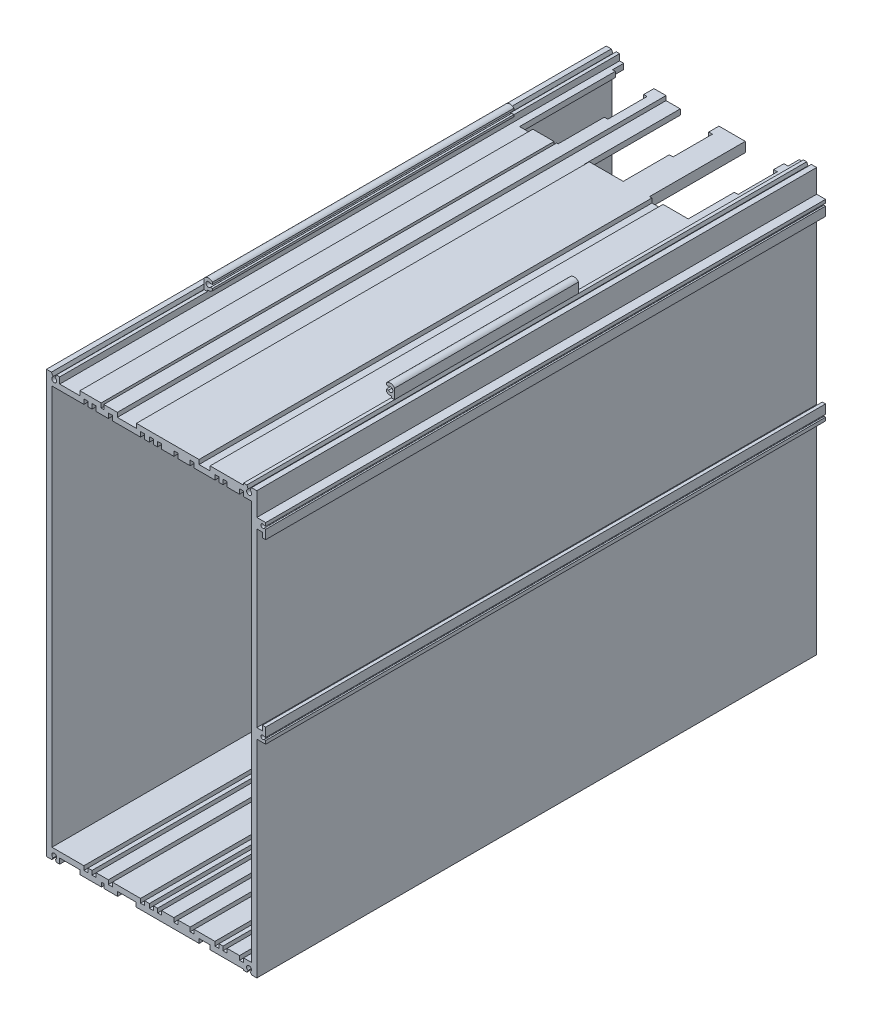
from build123d import *

# Parameters (mm, degrees)
BOSS_EXTRUDE1_DEPTH = 338
BOSS_EXTRUDE2_DEPTH = 188.8
CUT_EXTRUDE3_REACH  = 450.449
SKETCH4_W           = 77.8
SKETCH4_H           = 20.823727225
CUT_EXTRUDE4_REACH  = 446.826
SKETCH5_W           = 106
SKETCH5_H           = 6.75
CUT_EXTRUDE5_REACH  = 446.826
SKETCH6_W           = 23.35
SKETCH6_H           = 57.8
CUT_EXTRUDE6_REACH  = 451.922
SKETCH7_W           = 66.8
SKETCH7_H           = 11.633150893
CUT_EXTRUDE7_REACH  = 446.826
SKETCH8_W           = 2.25
SKETCH8_H           = 23.75


with BuildPart() as part:
    # Sketch2 → Boss-Extrude1 (new body)
    with BuildSketch(Plane.XY):
        with BuildLine():
            Line((14.499999531, 257.585773296), (14.499999531, 261.373383253))
            Line((14.499999531, 261.373383253), (12.499999531, 261.373383253))
            Line((12.499999531, 261.373383253), (11.766447114, 259.574707108))
            ThreePointArc((11.766447114, 259.574707108), (12.4449235, 259.022531512), (12.699999531, 258.185773296))
            ThreePointArc((12.699999531, 258.185773296), (10.428246686, 256.899539434), (10.494136136, 259.509312818))
            Line((10.494136136, 259.509312818), (9.499999531, 261.373383253))
            Line((9.499999531, 261.373383253), (6.499999531, 261.373383253))
            Line((6.499999531, 261.373383253), (6.499999531, 6.573383253))
            Line((6.499999531, 6.573383253), (9.699999531, 6.573383253))
            Line((9.699999531, 6.573383253), (10.453087922, 7.884956995))
            ThreePointArc((10.453087922, 7.884956995), (10.448456922, 10.483919553), (12.699999531, 9.185773296))
            ThreePointArc((12.699999531, 9.185773296), (12.47478685, 8.395256191), (11.866776475, 7.842118389))
            Line((11.866776475, 7.842118389), (12.496375142, 6.573383253))
            Line((12.496375142, 6.573383253), (14.496375142, 6.573383253))
            Line((14.496375142, 6.573383253), (14.496375142, 9.785773296))
            Line((14.496375142, 9.785773296), (26.596375142, 9.785773296))
            Line((26.596375142, 9.785773296), (26.596375142, 7.202035453))
            Line((26.596375142, 7.202035453), (39.696375142, 7.202035453))
            Line((39.696375142, 7.202035453), (39.696375142, 9.785773296))
            Line((39.696375142, 9.785773296), (41.199999531, 9.785773296))
            Line((41.199999531, 9.785773296), (41.199999531, 7.202035453))
            Line((41.199999531, 7.202035453), (49.449999531, 7.202035453))
            Line((49.449999531, 7.202035453), (49.449999531, 9.785773296))
            Line((49.449999531, 9.785773296), (60.549999531, 9.785773296))
            Line((60.549999531, 9.785773296), (60.549999531, 7.202035453))
            Line((60.549999531, 7.202035453), (98.649999531, 7.202035453))
            Line((98.649999531, 7.202035453), (98.649999531, 9.785773296))
            Line((98.649999531, 9.785773296), (105.249999531, 9.785773296))
            Line((105.249999531, 9.785773296), (105.249999531, 7.202035453))
            Line((105.249999531, 7.202035453), (125.499999531, 7.202035453))
            Line((125.499999531, 7.202035453), (125.499999531, 6.573383253))
            Line((125.499999531, 6.573383253), (127.499999531, 6.573383253))
            Line((127.499999531, 6.573383253), (128.131728013, 7.842861095))
            ThreePointArc((128.131728013, 7.842861095), (128.010191731, 10.461000193), (130.299999531, 9.185773296))
            ThreePointArc((130.299999531, 9.185773296), (130.098145789, 8.434230687), (129.54691114, 7.884956995))
            Line((129.54691114, 7.884956995), (130.299999531, 6.573383253))
            Line((130.299999531, 6.573383253), (133.499999531, 6.573383253))
            Line((133.499999531, 6.573383253), (133.499999531, 131.473383253))
            Line((133.499999531, 131.473383253), (138.849999531, 131.473383253))
            Line((138.849999531, 131.473383253), (138.849999531, 133.473383253))
            Line((138.849999531, 133.473383253), (137.935232058, 133.473383253))
            ThreePointArc((137.935232058, 133.473383253), (135.950499999, 134.164830282), (137.890474853, 134.973383253))
            Line((137.890474853, 134.973383253), (138.849999531, 134.973383253))
            Line((138.849999531, 134.973383253), (138.849999531, 140.423383253))
            Line((138.849999531, 140.423383253), (136.899999531, 140.423383253))
            Line((136.899999531, 140.423383253), (136.899999531, 137.473383253))
            Line((136.899999531, 137.473383253), (133.499999531, 137.473383253))
            Line((133.499999531, 137.473383253), (133.499999531, 241.373383253))
            Line((133.499999531, 241.373383253), (136.899999531, 241.373383253))
            Line((136.899999531, 241.373383253), (136.899999531, 238.423383253))
            Line((136.899999531, 238.423383253), (138.849999531, 238.423383253))
            Line((138.849999531, 238.423383253), (138.849999531, 243.873383253))
            Line((138.849999531, 243.873383253), (137.890474853, 243.873383253))
            ThreePointArc((137.890474853, 243.873383253), (135.950499999, 244.681936224), (137.935232058, 245.373383253))
            Line((137.935232058, 245.373383253), (138.849999531, 245.373383253))
            Line((138.849999531, 245.373383253), (138.849999531, 247.373383253))
            Line((138.849999531, 247.373383253), (133.499999531, 247.373383253))
            Line((133.499999531, 247.373383253), (133.499999531, 261.373383253))
            Line((133.499999531, 261.373383253), (130.299999531, 261.373383253))
            Line((130.299999531, 261.373383253), (129.438677048, 259.543009837))
            ThreePointArc((129.438677048, 259.543009837), (130.06649396, 258.989509485), (130.299999531, 258.185773296))
            ThreePointArc((130.299999531, 258.185773296), (127.963241315, 256.940849327), (128.233551948, 259.574707108))
            Line((128.233551948, 259.574707108), (127.499999531, 261.373383253))
            Line((127.499999531, 261.373383253), (125.499999531, 261.373383253))
            Line((125.499999531, 261.373383253), (125.499999531, 260.239968056))
            Line((125.499999531, 260.239968056), (105.299999531, 260.239968056))
            Line((105.299999531, 260.239968056), (105.299999531, 257.585773296))
            Line((105.299999531, 257.585773296), (98.599999531, 257.585773296))
            Line((98.599999531, 257.585773296), (98.599999531, 260.239968056))
            Line((98.599999531, 260.239968056), (60.799999531, 260.239968056))
            Line((60.799999531, 260.239968056), (60.799999531, 257.585773296))
            Line((60.799999531, 257.585773296), (49.299999531, 257.585773296))
            Line((49.299999531, 257.585773296), (49.299999531, 260.239968056))
            Line((49.299999531, 260.239968056), (41.099999531, 260.239968056))
            Line((41.099999531, 260.239968056), (41.099999531, 257.585773296))
            Line((41.099999531, 257.585773296), (39.499999531, 257.585773296))
            Line((39.499999531, 257.585773296), (39.499999531, 260.239968056))
            Line((39.499999531, 260.239968056), (26.699999531, 260.239968056))
            Line((26.699999531, 260.239968056), (26.699999531, 257.585773296))
            Line((26.699999531, 257.585773296), (14.499999531, 257.585773296))
        make_face()
        Polygon((9.799999531, 13.085773296), (9.799999531, 254.285773296), (29.099999531, 254.285773296), (29.099999531, 257.185773296), (31.549999531, 257.185773296), (31.549999531, 254.285773296), (33.999999531, 254.285773296), (33.999999531, 257.185773296), (36.449999531, 257.185773296), (36.449999531, 254.285773296), (43.849999531, 254.285773296), (43.849999531, 257.185773296), (46.299999531, 257.185773296), (46.299999531, 254.285773296), (63.299999531, 254.285773296), (63.299999531, 257.185773296), (65.749999531, 257.185773296), (65.749999531, 254.285773296), (68.649999531, 254.285773296), (68.649999531, 257.185773296), (71.099999531, 257.185773296), (71.099999531, 254.285773296), (73.549999531, 254.285773296), (73.549999531, 257.185773296), (75.999999531, 257.185773296), (75.999999531, 254.285773296), (83.399999531, 254.285773296), (83.399999531, 257.185773296), (85.849999531, 257.185773296), (85.849999531, 254.285773296), (93.249999531, 254.285773296), (93.249999531, 257.185773296), (95.699999531, 257.185773296), (95.699999531, 254.285773296), (108.199999531, 254.285773296), (108.199999531, 257.185773296), (110.649999531, 257.185773296), (110.649999531, 254.285773296), (113.099999531, 254.285773296), (113.099999531, 257.185773296), (115.549999531, 257.185773296), (115.549999531, 254.285773296), (123.049999531, 254.285773296), (123.049999531, 257.185773296), (125.499999531, 257.185773296), (125.499999531, 254.285773296), (130.199999531, 254.285773296), (130.199999531, 13.085773296), (125.499999531, 13.085773296), (125.499999531, 10.605647121), (123.049999531, 10.605647121), (123.049999531, 13.085773296), (115.549999531, 13.085773296), (115.549999531, 10.605647121), (113.099999531, 10.605647121), (113.099999531, 13.085773296), (110.649999531, 13.085773296), (110.649999531, 10.605647121), (108.199999531, 10.605647121), (108.199999531, 13.085773296), (95.699999531, 13.085773296), (95.699999531, 10.605647121), (93.249999531, 10.605647121), (93.249999531, 13.085773296), (85.849999531, 13.085773296), (85.849999531, 10.605647121), (83.399999531, 10.605647121), (83.399999531, 13.085773296), (75.999999531, 13.085773296), (75.999999531, 10.605647121), (73.549999531, 10.605647121), (73.549999531, 13.085773296), (71.099999531, 13.085773296), (71.099999531, 10.605647121), (68.649999531, 10.605647121), (68.649999531, 13.085773296), (65.749999531, 13.085773296), (65.749999531, 10.605647121), (63.299999531, 10.605647121), (63.299999531, 13.085773296), (46.299999531, 13.085773296), (46.299999531, 10.605647121), (43.849999531, 10.605647121), (43.849999531, 13.085773296), (36.449999531, 13.085773296), (36.449999531, 10.605647121), (33.999999531, 10.605647121), (33.999999531, 13.085773296), (31.549999531, 13.085773296), (31.549999531, 10.605647121), (29.099999531, 10.605647121), (29.099999531, 13.085773296), align=None, mode=Mode.SUBTRACT)
    extrude(amount=BOSS_EXTRUDE1_DEPTH)

    # Sketch3 → Boss-Extrude2 (add)
    with BuildSketch(Plane(origin=(0, 0, 60), x_dir=(-1, 0, 0), z_dir=(0, 0, -1))):
        with BuildLine():
            ThreePointArc((-17.499999531, 263.24640733), (-16.121371693, 262.388956123), (-14.499999531, 262.30535229))
            Line((-14.499999531, 262.30535229), (-14.499999531, 264.027871507))
            ThreePointArc((-14.499999531, 264.027871507), (-15.443429897, 263.94278526), (-16.249723759, 264.439968056))
            Line((-16.249723759, 264.439968056), (-17.499999531, 264.439968056))
            Line((-17.499999531, 264.439968056), (-17.499999531, 263.24640733))
        make_face()
        with BuildLine():
            Line((-14.499999531, 264.027871507), (-14.499999531, 262.30535229))
            ThreePointArc((-14.499999531, 262.30535229), (-13.376269152, 262.765773779), (-12.499999531, 263.606552859))
            Line((-12.499999531, 263.606552859), (-12.499999531, 267.373383253))
            ThreePointArc((-12.499999531, 267.373383253), (-13.376269152, 268.214162333), (-14.499999531, 268.674583822))
            Line((-14.499999531, 268.674583822), (-14.499999531, 266.777802835))
            ThreePointArc((-14.499999531, 266.777802835), (-13.844699353, 266.224622869), (-13.59955722, 265.402837171))
            ThreePointArc((-13.59955722, 265.402837171), (-13.844699353, 264.581051473), (-14.499999531, 264.027871507))
        make_face()
        with BuildLine():
            Line((-14.499999531, 262.30535229), (-14.499999531, 261.373383253))
            Line((-14.499999531, 261.373383253), (-12.499999531, 261.373383253))
            Line((-12.499999531, 261.373383253), (-12.499999531, 263.606552859))
            ThreePointArc((-12.499999531, 263.606552859), (-13.376269152, 262.765773779), (-14.499999531, 262.30535229))
        make_face()
        with BuildLine():
            ThreePointArc((-16.077786922, 266.539968056), (-15.323140468, 266.886080418), (-14.499999531, 266.777802835))
            Line((-14.499999531, 266.777802835), (-14.499999531, 268.674583822))
            ThreePointArc((-14.499999531, 268.674583822), (-16.121371693, 268.590979989), (-17.499999531, 267.733528783))
            Line((-17.499999531, 267.733528783), (-17.499999531, 266.539968056))
            Line((-17.499999531, 266.539968056), (-16.077786922, 266.539968056))
        make_face()
        with BuildLine():
            Line((-127.499999531, 263.606552859), (-127.499999531, 261.373383253))
            Line((-127.499999531, 261.373383253), (-125.499999531, 261.373383253))
            Line((-125.499999531, 261.373383253), (-125.499999531, 262.30535229))
            ThreePointArc((-125.499999531, 262.30535229), (-126.62372991, 262.765773779), (-127.499999531, 263.606552859))
        make_face()
        with BuildLine():
            Line((-127.499999531, 267.373383253), (-127.499999531, 263.606552859))
            ThreePointArc((-127.499999531, 263.606552859), (-126.62372991, 262.765773779), (-125.499999531, 262.30535229))
            Line((-125.499999531, 262.30535229), (-125.499999531, 264.027871507))
            ThreePointArc((-125.499999531, 264.027871507), (-126.400441842, 265.402837171), (-125.499999531, 266.777802835))
            Line((-125.499999531, 266.777802835), (-125.499999531, 268.674583822))
            ThreePointArc((-125.499999531, 268.674583822), (-126.62372991, 268.214162333), (-127.499999531, 267.373383253))
        make_face()
        with BuildLine():
            ThreePointArc((-122.499999531, 267.733528783), (-123.878627369, 268.590979989), (-125.499999531, 268.674583822))
            Line((-125.499999531, 268.674583822), (-125.499999531, 266.777802835))
            ThreePointArc((-125.499999531, 266.777802835), (-124.676858594, 266.886080418), (-123.922212141, 266.539968056))
            Line((-123.922212141, 266.539968056), (-122.499999531, 266.539968056))
            Line((-122.499999531, 266.539968056), (-122.499999531, 267.733528783))
        make_face()
        with BuildLine():
            Line((-125.499999531, 264.027871507), (-125.499999531, 262.30535229))
            ThreePointArc((-125.499999531, 262.30535229), (-123.878627369, 262.388956123), (-122.499999531, 263.24640733))
            Line((-122.499999531, 263.24640733), (-122.499999531, 264.439968056))
            Line((-122.499999531, 264.439968056), (-123.750275303, 264.439968056))
            ThreePointArc((-123.750275303, 264.439968056), (-124.556569165, 263.94278526), (-125.499999531, 264.027871507))
        make_face()
    extrude(amount=-BOSS_EXTRUDE2_DEPTH)

    # Sketch4 → Cut-Extrude3 (cut, up to next)
    with BuildSketch(Plane(origin=(127.499999531, 0, 0), x_dir=(0, 0, -1), z_dir=(1, 0, 0)), mode=Mode.PRIVATE) as cut_extrude3_sk1:
        with Locations((-98.9, 271.785246866)):
            Rectangle(SKETCH4_W, SKETCH4_H)
    cut_extrude3_tool1 = extrude(cut_extrude3_sk1.sketch, amount=-CUT_EXTRUDE3_REACH, mode=Mode.PRIVATE) & part.part
    add(cut_extrude3_tool1.solids().sort_by_distance((127.5, 271.785247, 98.9))[0], mode=Mode.SUBTRACT)

    # Sketch5 → Cut-Extrude4 (cut, up to next)
    with BuildSketch(Plane(origin=(0, 260.239968056, 0), x_dir=(1, 0, 0), z_dir=(0, 1, 0)), mode=Mode.PRIVATE) as cut_extrude4_sk1:
        with Locations((69.999999531, -3.375)):
            Rectangle(SKETCH5_W, SKETCH5_H)
    cut_extrude4_tool1 = extrude(cut_extrude4_sk1.sketch, amount=-CUT_EXTRUDE4_REACH, mode=Mode.PRIVATE) & part.part
    add(cut_extrude4_tool1.solids().sort_by_distance((70, 260.239968, 3.375))[0], mode=Mode.SUBTRACT)

    # Sketch6 → Cut-Extrude5 (cut, up to next)
    with BuildSketch(Plane(origin=(0, 260.239968056, 0), x_dir=(1, 0, 0), z_dir=(0, 1, 0)), mode=Mode.PRIVATE) as cut_extrude5_sk1:
        with Locations((108.824999531, -35.65)):
            Rectangle(SKETCH6_W, SKETCH6_H)
    cut_extrude5_tool1 = extrude(cut_extrude5_sk1.sketch, amount=-CUT_EXTRUDE5_REACH, mode=Mode.PRIVATE) & part.part
    # Sketch6 → Cut-Extrude5 (cut, up to next)
    with BuildSketch(Plane(origin=(0, 260.239968056, 0), x_dir=(1, 0, 0), z_dir=(0, 1, 0)), mode=Mode.PRIVATE) as cut_extrude5_sk2:
        with Locations((69.574999531, -35.65)):
            Rectangle(SKETCH6_W, SKETCH6_H)
    cut_extrude5_tool2 = extrude(cut_extrude5_sk2.sketch, amount=-CUT_EXTRUDE5_REACH, mode=Mode.PRIVATE) & part.part
    # Sketch6 → Cut-Extrude5 (cut, up to next)
    with BuildSketch(Plane(origin=(0, 260.239968056, 0), x_dir=(1, 0, 0), z_dir=(0, 1, 0)), mode=Mode.PRIVATE) as cut_extrude5_sk3:
        with Locations((30.324999531, -35.65)):
            Rectangle(SKETCH6_W, SKETCH6_H)
    cut_extrude5_tool3 = extrude(cut_extrude5_sk3.sketch, amount=-CUT_EXTRUDE5_REACH, mode=Mode.PRIVATE) & part.part
    add(cut_extrude5_tool1.solids().sort_by_distance((108.825, 260.239968, 35.65))[0], mode=Mode.SUBTRACT)
    add(cut_extrude5_tool2.solids().sort_by_distance((69.575, 260.239968, 35.65))[0], mode=Mode.SUBTRACT)
    add(cut_extrude5_tool3.solids().sort_by_distance((30.325, 260.239968, 35.65))[0], mode=Mode.SUBTRACT)

    # Sketch7 → Cut-Extrude6 (cut, up to next)
    with BuildSketch(Plane.ZY.offset(-12.499999531), mode=Mode.PRIVATE) as cut_extrude6_sk1:
        with Locations((33.4, 267.1899587)):
            Rectangle(SKETCH7_W, SKETCH7_H)
    cut_extrude6_tool1 = extrude(cut_extrude6_sk1.sketch, amount=-CUT_EXTRUDE6_REACH, mode=Mode.PRIVATE) & part.part
    add(cut_extrude6_tool1.solids().sort_by_distance((12.5, 267.189959, 33.4))[0], mode=Mode.SUBTRACT)

    # Sketch8 → Cut-Extrude7 (cut, up to next)
    with BuildSketch(Plane(origin=(0, 260.239968056, 0), x_dir=(1, 0, 0), z_dir=(0, 1, 0)), mode=Mode.PRIVATE) as cut_extrude7_sk1:
        with Locations((121.624999531, -24.825)):
            Rectangle(SKETCH8_W, SKETCH8_H)
    cut_extrude7_tool1 = extrude(cut_extrude7_sk1.sketch, amount=-CUT_EXTRUDE7_REACH, mode=Mode.PRIVATE) & part.part
    # Sketch8 → Cut-Extrude7 (cut, up to next)
    with BuildSketch(Plane(origin=(0, 260.239968056, 0), x_dir=(1, 0, 0), z_dir=(0, 1, 0)), mode=Mode.PRIVATE) as cut_extrude7_sk2:
        with Locations((82.374999531, -24.825)):
            Rectangle(SKETCH8_W, SKETCH8_H)
    cut_extrude7_tool2 = extrude(cut_extrude7_sk2.sketch, amount=-CUT_EXTRUDE7_REACH, mode=Mode.PRIVATE) & part.part
    # Sketch8 → Cut-Extrude7 (cut, up to next)
    with BuildSketch(Plane(origin=(0, 260.239968056, 0), x_dir=(1, 0, 0), z_dir=(0, 1, 0)), mode=Mode.PRIVATE) as cut_extrude7_sk3:
        with Locations((42.958678124, -24.825)):
            Rectangle(SKETCH8_W, SKETCH8_H)
    cut_extrude7_tool3 = extrude(cut_extrude7_sk3.sketch, amount=-CUT_EXTRUDE7_REACH, mode=Mode.PRIVATE) & part.part
    add(cut_extrude7_tool1.solids().sort_by_distance((121.625, 260.239968, 24.825))[0], mode=Mode.SUBTRACT)
    add(cut_extrude7_tool2.solids().sort_by_distance((82.375, 260.239968, 24.825))[0], mode=Mode.SUBTRACT)
    add(cut_extrude7_tool3.solids().sort_by_distance((42.958678, 260.239968, 24.825))[0], mode=Mode.SUBTRACT)


solid = part.part
